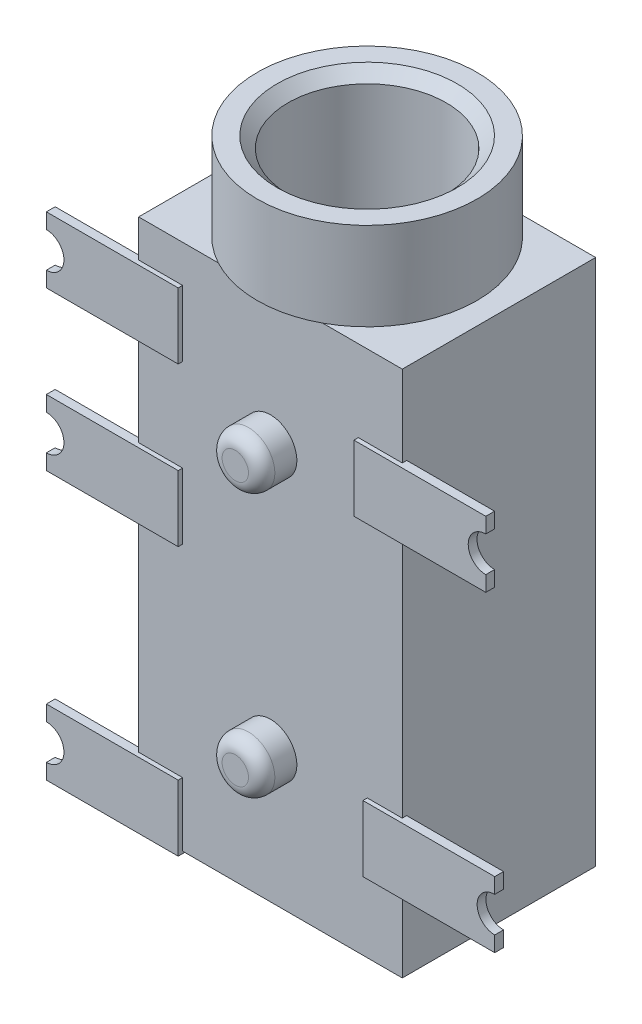
from build123d import *

# Parameters (mm, degrees)
SKETCH_1_W             = 6
SKETCH_1_H             = 4.4
EXTRUDE_1_DEPTH        = 12
SKETCH_2_R             = 2.5
EXTRUDE_2_DEPTH        = 2
SKETCH_3_R             = 1.8
CUT_EXTRUDE_1_DEPTH    = 13
EXTRUDE_3_DEPTH        = 0.1
EXTRUDE_3_DEPTH_BACK   = 0.1
SKETCH_5_W             = 3
SKETCH_5_H             = 1.5
EXTRUDE_3_2_DEPTH      = 0.1
EXTRUDE_3_2_DEPTH_BACK = 0.1
EXTRUDE_3_3_DEPTH      = 0.1
EXTRUDE_3_3_DEPTH_BACK = 0.1
EXTRUDE_3_4_DEPTH      = 0.1
EXTRUDE_3_4_DEPTH_BACK = 0.1
EXTRUDE_3_5_DEPTH      = 0.1
EXTRUDE_3_5_DEPTH_BACK = 0.1
SKETCH_6_R             = 0.4
CUT_EXTRUDE_2_DEPTH    = 0.2
CHAMFER_1_SIZE         = 0.25
SKETCH_7_R             = 0.6
EXTRUDE_4_DEPTH        = 0.8
FILLET_1_R             = 0.3


with BuildPart() as part:
    # 草图1 → 凸台-拉伸1 (new body)
    with BuildSketch(Plane(origin=(0, 0, 0), x_dir=(1, 0, 0), z_dir=(0, 1, 0))):
        Rectangle(SKETCH_1_W, SKETCH_1_H)
    extrude(amount=EXTRUDE_1_DEPTH)

    # 草图2 → 凸台-拉伸2 (add)
    with BuildSketch(Plane(origin=(0, 12, 0), x_dir=(1, 0, 0), z_dir=(0, 1, 0))):
        with Locations(Location((0, 0, 0), (0, 0, 61.642363424))):
            Circle(SKETCH_2_R)
    extrude(amount=EXTRUDE_2_DEPTH)

    # 草图3 → 切除-拉伸1 (cut)
    with BuildSketch(Plane(origin=(0, 14, 0), x_dir=(1, 0, 0), z_dir=(0, 1, 0))):
        with Locations(Location((0, 0, 0), (0, 0, 270))):
            Circle(SKETCH_3_R)
    extrude(amount=-CUT_EXTRUDE_1_DEPTH, mode=Mode.SUBTRACT)

    # 倒角1
    chamfer_1_edges = [part.edges().sort_by_distance(p)[0] for p in [
        (0, 14, -1.8),
    ]]
    chamfer(chamfer_1_edges, length=CHAMFER_1_SIZE)

    # 草图7 → 凸台-拉伸4 (add)
    with BuildSketch(Plane.XY.offset(2.2)):
        with Locations(Location((0, 9, 0), (0, 0, 180))):
            Circle(SKETCH_7_R)
        with Locations(Location((0, 3, 0), (0, 0, 180))):
            Circle(SKETCH_7_R)
    extrude(amount=EXTRUDE_4_DEPTH)

    # 圆角1
    fillet_1_edges = [part.edges().sort_by_distance(p)[0] for p in [
        (0.6, 9, 3),
        (0.6, 3, 3),
    ]]
    fillet(fillet_1_edges, radius=FILLET_1_R)


with BuildPart() as body_2:
    # 草图5 → 凸台-拉伸3 (new, two sides: drawn at the far end of the back side and taken through both)
    with BuildSketch(Plane.XY.offset(2.2).offset(-EXTRUDE_3_DEPTH_BACK)):
        with Locations((-3.5, 10.4)):
            Rectangle(SKETCH_5_W, SKETCH_5_H)
    extrude(amount=EXTRUDE_3_DEPTH + EXTRUDE_3_DEPTH_BACK)


with BuildPart() as body_3:
    # 草图5 → Extrude 3 2 (new, two sides: drawn at the far end of the back side and taken through both)
    with BuildSketch(Plane.XY.offset(2.2).offset(-EXTRUDE_3_2_DEPTH_BACK)):
        with Locations((-3.5, 6.8)):
            Rectangle(SKETCH_5_W, SKETCH_5_H)
    extrude(amount=EXTRUDE_3_2_DEPTH + EXTRUDE_3_2_DEPTH_BACK)


with BuildPart() as body_4:
    # 草图5 → Extrude 3 3 (new, two sides: drawn at the far end of the back side and taken through both)
    with BuildSketch(Plane.XY.offset(2.2).offset(-EXTRUDE_3_3_DEPTH_BACK)):
        with Locations((-3.5, 0.7)):
            Rectangle(SKETCH_5_W, SKETCH_5_H)
    extrude(amount=EXTRUDE_3_3_DEPTH + EXTRUDE_3_3_DEPTH_BACK)


with BuildPart() as body_5:
    # 草图5 → Extrude 3 4 (new, two sides: drawn at the far end of the back side and taken through both)
    with BuildSketch(Plane.XY.offset(2.2).offset(-EXTRUDE_3_4_DEPTH_BACK)):
        with Locations((3.5, 9.4)):
            Rectangle(SKETCH_5_W, SKETCH_5_H)
    extrude(amount=EXTRUDE_3_4_DEPTH + EXTRUDE_3_4_DEPTH_BACK)


with BuildPart() as body_6:
    # 草图5 → Extrude 3 5 (new, two sides: drawn at the far end of the back side and taken through both)
    with BuildSketch(Plane.XY.offset(2.2).offset(-EXTRUDE_3_5_DEPTH_BACK)):
        with Locations((3.703252842, 2.4)):
            Rectangle(SKETCH_5_W, SKETCH_5_H)
    extrude(amount=EXTRUDE_3_5_DEPTH + EXTRUDE_3_5_DEPTH_BACK)


with BuildPart() as cut_extrude_2_tool:
    # 草图6 → 切除-拉伸2 (new body)
    with BuildSketch(Plane.XY.offset(2.3)):
        with Locations((-5, 10.4)):
            Circle(SKETCH_6_R)
        with Locations((-5, 6.8)):
            Circle(SKETCH_6_R)
        with Locations((5, 9.4)):
            Circle(SKETCH_6_R)
        with Locations((5.203252842, 2.4)):
            Circle(SKETCH_6_R)
        with Locations((-5, 0.7)):
            Circle(SKETCH_6_R)
    extrude(amount=-CUT_EXTRUDE_2_DEPTH)


with BuildPart() as body_2_1:
    add(body_2.part)

    # 切除-拉伸2: cut by cut_extrude_2_tool
    add(cut_extrude_2_tool.part, mode=Mode.SUBTRACT)


with BuildPart() as body_3_1:
    add(body_3.part)

    # 切除-拉伸2: cut by cut_extrude_2_tool
    add(cut_extrude_2_tool.part, mode=Mode.SUBTRACT)


with BuildPart() as body_4_1:
    add(body_4.part)

    # 切除-拉伸2: cut by cut_extrude_2_tool
    add(cut_extrude_2_tool.part, mode=Mode.SUBTRACT)


with BuildPart() as body_5_1:
    add(body_5.part)

    # 切除-拉伸2: cut by cut_extrude_2_tool
    add(cut_extrude_2_tool.part, mode=Mode.SUBTRACT)


with BuildPart() as body_6_1:
    add(body_6.part)

    # 切除-拉伸2: cut by cut_extrude_2_tool
    add(cut_extrude_2_tool.part, mode=Mode.SUBTRACT)


solid = Compound([part.part, body_2_1.part, body_3_1.part, body_4_1.part, body_5_1.part, body_6_1.part])
